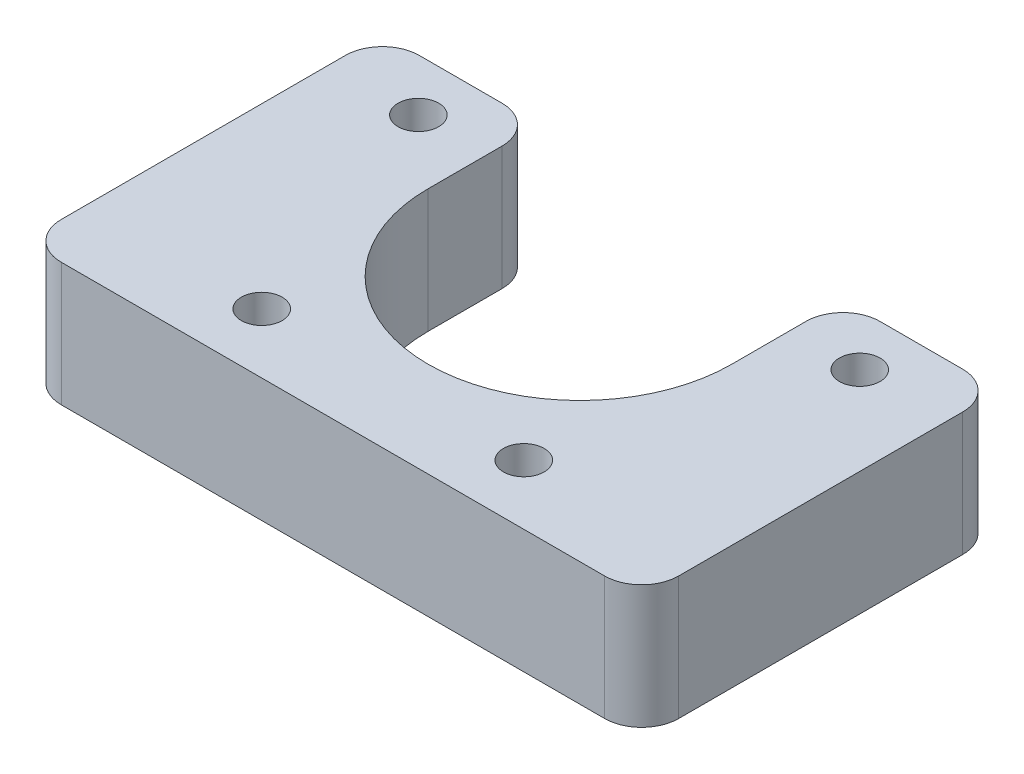
from build123d import *

# Parameters (mm, degrees)
SKETCH_1_R      = 1.65
EXTRUDE_1_DEPTH = 10
FILLET_1_R      = 3


with BuildPart() as part:
    # 草图1 → 凸台-拉伸1 (new body)
    with BuildSketch(Plane(origin=(0, 0, 0), x_dir=(1, 0, 0), z_dir=(0, 1, 0))):
        with BuildLine():
            Line((-25, 30), (-25, 10))
            Line((-25, 10), (25, 10))
            Line((25, 10), (25, 30))
            Line((25, 30), (25, 39))
            Line((25, 39), (12.3, 39))
            Line((12.3, 39), (12.3, 30))
            ThreePointArc((12.3, 30), (0, 17.7), (-12.3, 30))
            Line((-12.3, 30), (-12.3, 39))
            Line((-12.3, 39), (-25, 39))
            Line((-25, 39), (-25, 30))
        make_face()
        with Locations(Location((-10.611164072, 14.845687181, 0), (0, 0, 270))):
            Circle(SKETCH_1_R, mode=Mode.SUBTRACT)
        with Locations(Location((-17.869627786, 34.788152334, 0), (0, 0, 270))):
            Circle(SKETCH_1_R, mode=Mode.SUBTRACT)
        with Locations(Location((10.611164072, 14.845687181, 0), (0, 0, 90))):
            Circle(SKETCH_1_R, mode=Mode.SUBTRACT)
        with Locations(Location((17.869627786, 34.788152334, 0), (0, 0, 90))):
            Circle(SKETCH_1_R, mode=Mode.SUBTRACT)
    extrude(amount=EXTRUDE_1_DEPTH)

    # 圆角1
    fillet_1_edges = [part.edges().sort_by_distance(p)[0] for p in [
        (25, 5, -10),
        (-25, 5, -10),
        (-25, 5, -39),
        (-12.3, 5, -39),
        (12.3, 5, -39),
        (25, 5, -39),
    ]]
    fillet(fillet_1_edges, radius=FILLET_1_R)


solid = part.part
